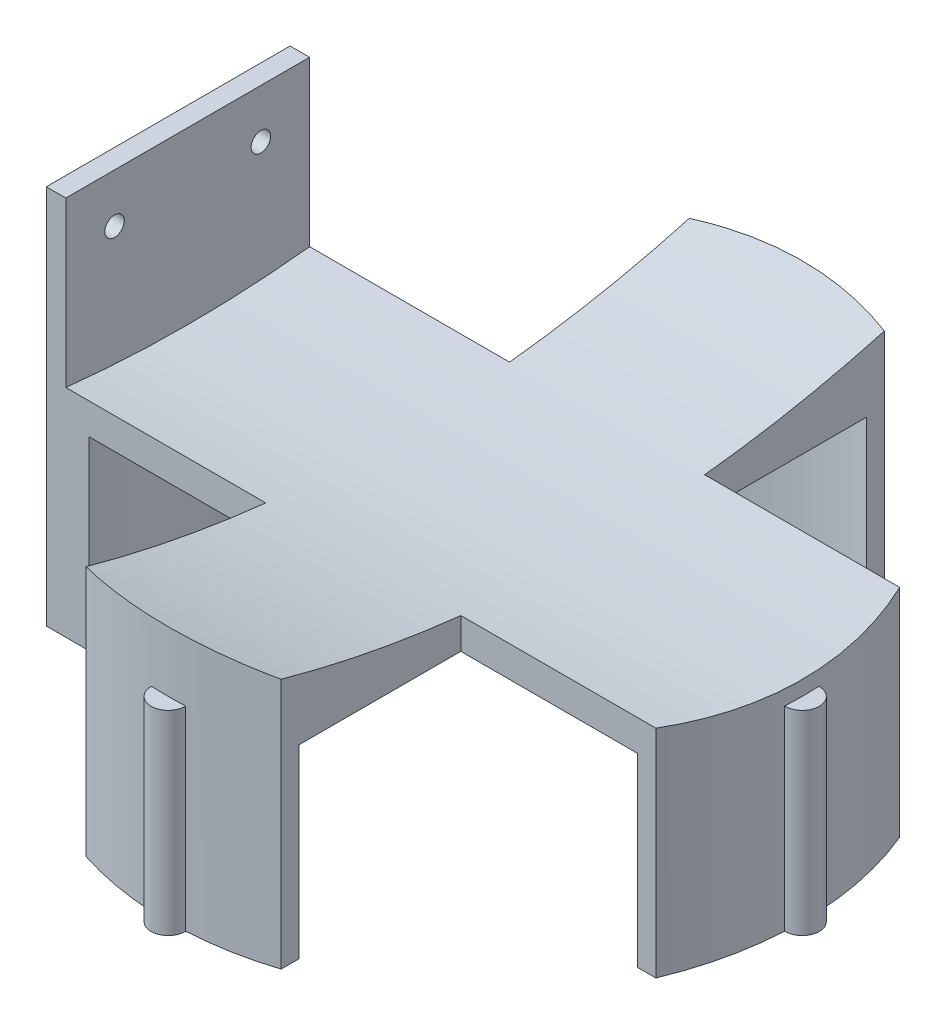
from build123d import *

# Parameters (mm, degrees)
SKETCH_1_W           = 50
SKETCH_1_H           = 40
EXTRUDE_1_DEPTH      = 4
SKETCH_2_R           = 2
CUT_EXTRUDE_1_DEPTH  = 4
EXTRUDE_2_DEPTH      = 180
CUT_EXTRUDE_START    = -60
CUT_EXTRUDE_2_DEPTH  = 60
CUT_EXTRUDE_3_DEPTH  = 60
EXTRUDE_3_REACH      = 191.95
EXTRUDE_3_END_RADIUS = 230
EXTRUDE_START        = 38
EXTRUDE_4_DEPTH      = 38
CUT_EXTRUDE_4_DEPTH  = 211.154705038
SKETCH_9_R           = 3.5
EXTRUDE_5_DEPTH      = 40
SKETCH_10_R          = 1.5
CUT_EXTRUDE_5_DEPTH  = 30
CHAMFER_1_SIZE       = 0.5
EXTRUDE_6_REACH      = 171.111
EXTRUDE_6_END_RADIUS = 235
EXTRUDE_7_REACH      = 171.111


with BuildPart() as part:
    # 草图1 → 凸台-拉伸1 (new body)
    with BuildSketch(Plane(origin=(0, 0, 0), x_dir=(0, 0, -1), z_dir=(1, 0, 0))):
        with Locations((0, -20)):
            Rectangle(SKETCH_1_W, SKETCH_1_H)
    extrude(amount=EXTRUDE_1_DEPTH)

    # 草图2 → 切除-拉伸1 (cut)
    with BuildSketch(Plane(origin=(4, 0, 0), x_dir=(0, 0, -1), z_dir=(1, 0, 0))):
        with Locations((-15, -10)):
            Circle(SKETCH_2_R)
        with Locations((15, -10)):
            Circle(SKETCH_2_R)
    extrude(amount=-CUT_EXTRUDE_1_DEPTH, mode=Mode.SUBTRACT)

    # 草图3 → 凸台-拉伸2 (add)
    with BuildSketch(Plane(origin=(4, 0, 0), x_dir=(0, 0, -1), z_dir=(1, 0, 0))):
        with BuildLine():
            Line((-25, -33.637267303), (-25, -38.666428911))
            ThreePointArc((-25, -38.666428911), (0, -40), (25, -38.666428911))
            Line((25, -38.666428911), (25, -33.637267303))
            ThreePointArc((25, -33.637267303), (0, -35), (-25, -33.637267303))
        make_face()
    extrude(amount=EXTRUDE_2_DEPTH)

    # 草图4 → 切除-拉伸2 (cut)
    with BuildSketch(Plane(origin=(4, 0, 0), x_dir=(0, 0, -1), z_dir=(1, 0, 0)).offset(CUT_EXTRUDE_START)):
        with BuildLine():
            Line((25, -40), (25, -38.666428911))
            ThreePointArc((25, -38.666428911), (12.517771485, -39.666370401), (0, -40))
            Line((0, -40), (25, -40))
        make_face()
    extrude(amount=CUT_EXTRUDE_2_DEPTH, mode=Mode.SUBTRACT)

    # 草图5 → 切除-拉伸3 (cut)
    with BuildSketch(Plane(origin=(4, 0, 0), x_dir=(0, 0, -1), z_dir=(1, 0, 0)).offset(CUT_EXTRUDE_START)):
        with BuildLine():
            Line((-25, -38.666428911), (-25, -40))
            Line((-25, -40), (0, -40))
            ThreePointArc((0, -40), (-12.517771485, -39.666370401), (-25, -38.666428911))
        make_face()
    extrude(amount=CUT_EXTRUDE_3_DEPTH, mode=Mode.SUBTRACT)

    # 凸台-拉伸3: up to this cylinder (the profile starts outside it)
    extrude_3_end = Plane(origin=(65.000728, 195, 0), z_dir=(-1, 0, 0)) * Cylinder(EXTRUDE_3_END_RADIUS, 844.9, mode=Mode.PRIVATE)
    # 草图6 → 凸台-拉伸3 (add, up to the surface)
    with BuildSketch(Plane(origin=(0, -40, 0), x_dir=(-1, 0, 0), z_dir=(0, -1, 0)), mode=Mode.PRIVATE) as extrude_3_sk1:
        with BuildLine():
            Line((-85.002334196, 61.845829501), (-85.002334196, 25))
            Line((-85.002334196, 25), (-125, 25))
            ThreePointArc((-125, 25), (-130, 0), (-125, -25))
            Line((-125, -25), (-85.002334196, -25))
            Line((-85.002334196, -25), (-85.002334196, -61.845829501))
            ThreePointArc((-85.002334196, -61.845829501), (-65.002453212, -64.999999954), (-45.002334196, -61.84733917))
            Line((-45.002334196, -61.84733917), (-45.002334196, -25))
            Line((-45.002334196, -25), (-5, -25))
            ThreePointArc((-5, -25), (0, 0), (-5, 25))
            Line((-5, 25), (-45.002334196, 25))
            Line((-45.002334196, 25), (-45.002334196, 61.84733917))
            ThreePointArc((-45.002334196, 61.84733917), (-65.002453212, 64.999999954), (-85.002334196, 61.845829501))
        make_face()
    extrude_3_tool1 = extrude(extrude_3_sk1.sketch, amount=-EXTRUDE_3_REACH, mode=Mode.PRIVATE) - extrude_3_end
    extrude_3 = extrude_3_tool1.solids().sort_by_distance((65.000728, -40, 0))[0]
    add(extrude_3)

    # 镜向1: 凸台-拉伸3 across plane
    add(extrude_3.mirror(Plane.XY))

    # 草图7 → 凸台-拉伸4 (add)
    with BuildSketch(Plane.XZ.offset(40).offset(EXTRUDE_START)):
        with BuildLine():
            Line((5, -25), (8.810588186, -25))
            ThreePointArc((8.810588186, -25), (3.5, 0), (8.810588186, 25))
            Line((8.810588186, 25), (5, 25))
            ThreePointArc((5, 25), (1.26225608, 12.747548784), (0, 0))
            ThreePointArc((0, 0), (1.26225608, -12.747548784), (5, -25))
        make_face()
        with BuildLine():
            Line((45.002334196, -58.157917452), (45.002334196, -61.84733917))
            ThreePointArc((45.002334196, -61.84733917), (65.002453212, -64.999999954), (85.002334196, -61.845829501))
            Line((85.002334196, -61.845829501), (85.002334196, -58.156312011))
            ThreePointArc((85.002334196, -58.156312011), (65.002468367, -61.49999995), (45.002334196, -58.157917452))
        make_face()
        with BuildLine():
            Line((121.189411814, -25), (125, -25))
            ThreePointArc((125, -25), (128.73774392, -12.747548784), (130, 0))
            ThreePointArc((130, 0), (128.73774392, 12.747548784), (125, 25))
            Line((125, 25), (121.189411814, 25))
            ThreePointArc((121.189411814, 25), (126.5, 0), (121.189411814, -25))
        make_face()
        with BuildLine():
            Line((85.002334196, 58.156312011), (85.002334196, 61.845829501))
            ThreePointArc((85.002334196, 61.845829501), (65.002453212, 64.999999954), (45.002334196, 61.84733917))
            Line((45.002334196, 61.84733917), (45.002334196, 58.157917452))
            ThreePointArc((45.002334196, 58.157917452), (65.002468367, 61.49999995), (85.002334196, 58.156312011))
        make_face()
    extrude(amount=-EXTRUDE_4_DEPTH)

    # 草图8 → 切除-拉伸4 (cut, through all)
    with BuildSketch(Plane.XZ.offset(78)):
        with BuildLine():
            Line((184, 25), (125, 25))
            ThreePointArc((125, 25), (130, 0), (125, -25))
            Line((125, -25), (184, -25))
            Line((184, -25), (184, 25))
        make_face()
    extrude(amount=-CUT_EXTRUDE_4_DEPTH, mode=Mode.SUBTRACT)

    # 草图9 → 凸台-拉伸5 (add)
    with BuildSketch(Plane.XZ.offset(78)):
        with Locations((130, 0)):
            Circle(SKETCH_9_R)
        with Locations((65.002453212, -64.999999954)):
            Circle(SKETCH_9_R)
        with Locations((65.002453212, 64.999999954)):
            Circle(SKETCH_9_R)
    extrude(amount=-EXTRUDE_5_DEPTH)

    # 草图10 → 切除-拉伸5 (cut)
    with BuildSketch(Plane.XZ.offset(78)):
        with Locations(Location((65.002453212, 64.999999954, 0), (0, 0, 270))):
            Circle(SKETCH_10_R)
        with Locations(Location((130, 0, 0), (0, 0, 270))):
            Circle(SKETCH_10_R)
        with Locations(Location((65.002453212, -64.999999954, 0), (0, 0, 270))):
            Circle(SKETCH_10_R)
    extrude(amount=-CUT_EXTRUDE_5_DEPTH, mode=Mode.SUBTRACT)

    # 倒角1
    chamfer_1_edges = [part.edges().sort_by_distance(p)[0] for p in [
        (65.002453212, -78, 66.499999954),
        (130, -78, 1.5),
        (65.002453212, -78, -63.499999954),
    ]]
    chamfer(chamfer_1_edges, length=CHAMFER_1_SIZE)

    # 凸台-拉伸6: up to this cylinder (the profile starts outside it)
    extrude_6_end = Plane(origin=(1.489564, 195, 0), z_dir=(-1, 0, 0)) * Cylinder(EXTRUDE_6_END_RADIUS, 813.222, mode=Mode.PRIVATE)
    # 草图11 → 凸台-拉伸6 (add, up to the surface)
    with BuildSketch(Plane.XZ.offset(78), mode=Mode.PRIVATE) as extrude_6_sk1:
        with BuildLine():
            Line((0, 25), (0, 0))
            ThreePointArc((0, 0), (1.26225608, 12.747548784), (5, 25))
            Line((5, 25), (0, 25))
        make_face()
    extrude_6_tool1 = extrude(extrude_6_sk1.sketch, amount=-EXTRUDE_6_REACH, mode=Mode.PRIVATE) - extrude_6_end
    add(extrude_6_tool1.solids().sort_by_distance((1.489564, -78, 18.799089))[0])

    # 草图12 → 凸台-拉伸7 (add, up to next)
    with BuildSketch(Plane.XZ.offset(78), mode=Mode.PRIVATE) as extrude_7_sk1:
        with BuildLine():
            Line((0, -25), (5, -25))
            ThreePointArc((5, -25), (1.26225608, -12.747548784), (0, 0))
            Line((0, 0), (0, -25))
        make_face()
    extrude_7_tool1 = extrude(extrude_7_sk1.sketch, amount=-EXTRUDE_7_REACH, mode=Mode.PRIVATE) - part.part
    add(extrude_7_tool1.solids().sort_by_distance((1.489564, -78, -18.799089))[0])


solid = part.part
